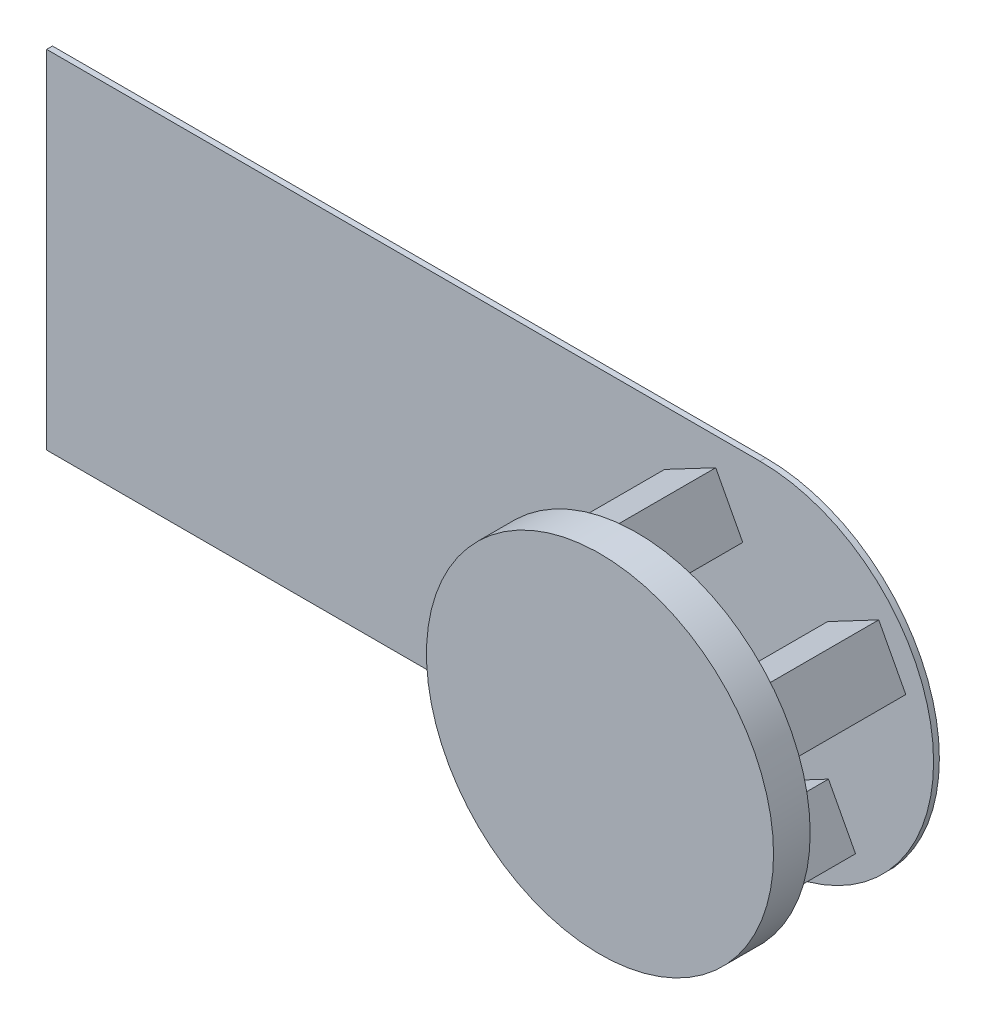
from build123d import *

# Parameters (mm, degrees)
BOSS_EXTRUDE1_DEPTH = 3
BOSS_EXTRUDE2_DEPTH = 64
SKETCH3_R           = 90
BOSS_EXTRUDE4_DEPTH = 19


with BuildPart() as part:
    # Sketch1 → Boss-Extrude1 (new body)
    with BuildSketch(Plane.XY):
        with BuildLine():
            Line((-131.94247797, 0), (238.05752203, 0))
            ThreePointArc((238.05752203, 0), (328.05752203, 90), (238.05752203, 180))
            Line((238.05752203, 180), (-131.94247797, 180))
            Line((-131.94247797, 180), (-131.94247797, 0))
        make_face()
    extrude(amount=BOSS_EXTRUDE1_DEPTH)

    # Sketch2 → Boss-Extrude2 (add)
    # profile 1 of 4: a face of its own
    with BuildSketch(Plane.XY.offset(3)):
        Polygon((203.021580666, 54.507604342), (176.500529327, 40.484985617), (162.477910603, 67.006036956), (188.998961942, 81.02865568), align=None)
        Polygon((177.750372588, 44.539352624), (166.532277609, 65.756193695), (187.74911868, 76.974288674), (198.967213659, 55.757447603), align=None, mode=Mode.SUBTRACT)
    # profile 2 of 4: a face of its own
    with BuildSketch(Plane.XY.offset(3)):
        Polygon((287.572536413, 28.443007297), (261.051485074, 14.420388572), (247.02886635, 40.941439911), (273.549917689, 54.964058635), align=None)
        Polygon((262.301328336, 18.474755579), (251.083233356, 39.69159665), (272.300074427, 50.909691629), (283.518169407, 29.692850558), align=None, mode=Mode.SUBTRACT)
    # profile 3 of 4: a face of its own
    with BuildSketch(Plane.XY.offset(3)):
        Polygon((299.614514734, 139.515014383), (313.637133458, 112.993963044), (287.116082119, 98.97134432), (273.093463395, 125.492395658), align=None)
        Polygon((309.582766452, 114.243806305), (288.365925381, 103.025711326), (277.147830401, 124.242552397), (298.364671472, 135.460647376), align=None, mode=Mode.SUBTRACT)
    # profile 4 of 4: a face of its own
    with BuildSketch(Plane.XY.offset(3)):
        Polygon((188.542507648, 151.556992703), (215.063558987, 165.579611428), (229.086177711, 139.058560089), (202.565126372, 125.035941365), align=None)
        Polygon((203.814969633, 129.090308371), (192.596874654, 150.307149442), (213.813715725, 161.525244421), (225.031810705, 140.30840335), align=None, mode=Mode.SUBTRACT)
    extrude(amount=BOSS_EXTRUDE2_DEPTH)

    # Sketch3 → Boss-Extrude4 (add)
    with BuildSketch(Plane.XY.offset(67)):
        with Locations((238.05752203, 90)):
            Circle(SKETCH3_R)
    extrude(amount=BOSS_EXTRUDE4_DEPTH)


solid = part.part
